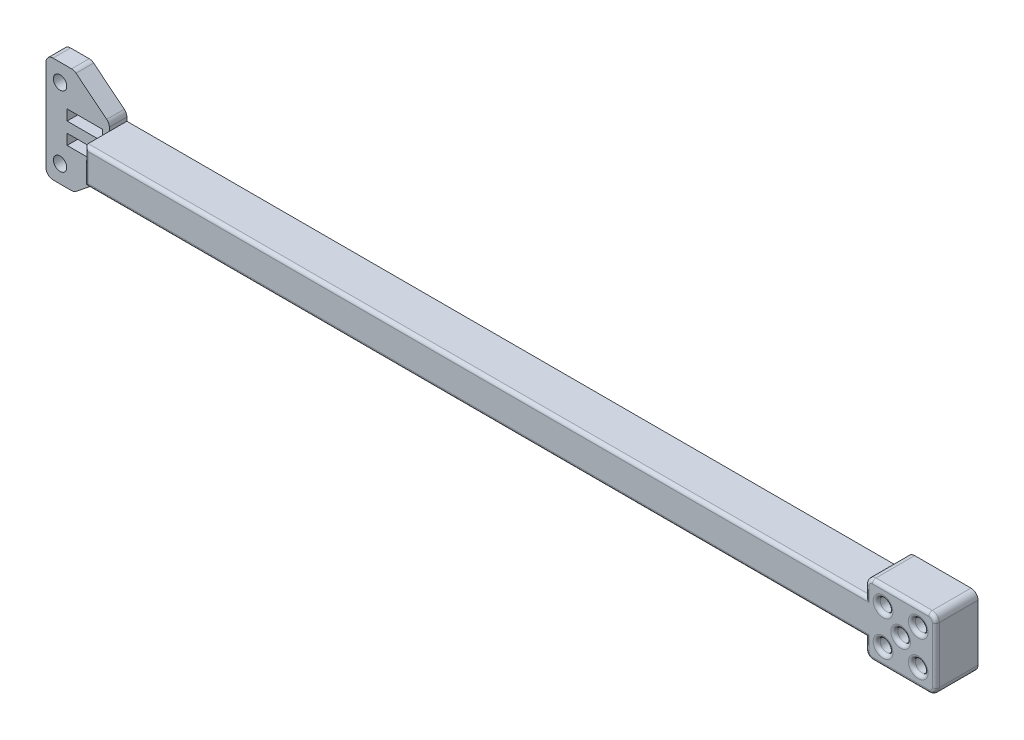
from build123d import *

# Parameters (mm, degrees)
SKETCH1_R           = 2.413
SKETCH1_W           = 12.7
SKETCH1_H           = 3.81
SKETCH1_R_2         = 2.286
BOSS_EXTRUDE1_DEPTH = 6.35
FILLET1_R           = 2.54
SKETCH3_R           = 2.286
BOSS_EXTRUDE3_DEPTH = 8.89
SKETCH7_R           = 4.445
CUT_EXTRUDE2_DEPTH  = 2.54
FILLET3_R           = 1.27


with BuildPart() as part:
    # Sketch1 → Boss-Extrude1 (new body)
    with BuildSketch(Plane.XY):
        Polygon((-140.97, -8.8265), (-140.97, -6.2865), (140.97, -6.2865), (140.97, -12.7), (166.37, -12.7), (166.37, 12.7), (140.97, 12.7), (140.97, 6.2865), (-140.97, 6.2865), (-140.97, 8.8265), (-153.67, 19.05), (-163.83, 19.05), (-163.83, -19.05), (-153.67, -19.05), align=None)
        with Locations((-158.75, -12.7)):
            Circle(SKETCH1_R, mode=Mode.SUBTRACT)
        with Locations((-149.86, -3.81)):
            Rectangle(SKETCH1_W, SKETCH1_H, mode=Mode.SUBTRACT)
        with Locations((-149.86, 3.81)):
            Rectangle(SKETCH1_W, SKETCH1_H, mode=Mode.SUBTRACT)
        with Locations((-158.75, 12.7)):
            Circle(SKETCH1_R, mode=Mode.SUBTRACT)
        with Locations((160.02, 6.35)):
            Circle(SKETCH1_R_2, mode=Mode.SUBTRACT)
        with Locations((147.32, -6.35)):
            Circle(SKETCH1_R_2, mode=Mode.SUBTRACT)
        with Locations((160.02, -6.35)):
            Circle(SKETCH1_R_2, mode=Mode.SUBTRACT)
        with Locations((153.67, 0)):
            Circle(SKETCH1_R_2, mode=Mode.SUBTRACT)
        with Locations((147.32, 6.35)):
            Circle(SKETCH1_R_2, mode=Mode.SUBTRACT)
    extrude(amount=BOSS_EXTRUDE1_DEPTH)

    # Fillet1
    fillet1_edges = [part.edges().sort_by_distance(p)[0] for p in [
        (-140.97, -8.8265, 3.175),
        (-153.67, -19.05, 3.175),
        (-163.83, -19.05, 3.175),
        (-163.83, 19.05, 3.175),
        (-153.67, 19.05, 3.175),
        (-140.97, 8.8265, 3.175),
        (140.97, 12.7, 3.175),
        (140.97, -12.7, 3.175),
        (166.37, -12.7, 3.175),
        (166.37, 12.7, 3.175),
    ]]
    fillet(fillet1_edges, radius=FILLET1_R)

    # Sketch3 → Boss-Extrude3 (add)
    with BuildSketch(Plane.XY.offset(6.35)):
        with BuildLine():
            Line((-140.97, -6.2865), (-140.97, 6.2865))
            Line((-140.97, 6.2865), (140.97, 6.2865))
            Line((140.97, 6.2865), (140.97, 10.16))
            ThreePointArc((140.97, 10.16), (141.713948776, 11.956051224), (143.51, 12.7))
            Line((143.51, 12.7), (163.83, 12.7))
            ThreePointArc((163.83, 12.7), (165.626051224, 11.956051224), (166.37, 10.16))
            Line((166.37, 10.16), (166.37, -10.16))
            ThreePointArc((166.37, -10.16), (165.626051224, -11.956051224), (163.83, -12.7))
            Line((163.83, -12.7), (143.51, -12.7))
            ThreePointArc((143.51, -12.7), (141.713948776, -11.956051224), (140.97, -10.16))
            Line((140.97, -10.16), (140.97, -6.2865))
            Line((140.97, -6.2865), (-140.97, -6.2865))
        make_face()
        with Locations((147.32, 6.35)):
            Circle(SKETCH3_R, mode=Mode.SUBTRACT)
        with Locations((153.67, 0)):
            Circle(SKETCH3_R, mode=Mode.SUBTRACT)
        with Locations((147.32, -6.35)):
            Circle(SKETCH3_R, mode=Mode.SUBTRACT)
        with Locations((160.02, 6.35)):
            Circle(SKETCH3_R, mode=Mode.SUBTRACT)
        with Locations((160.02, -6.35)):
            Circle(SKETCH3_R, mode=Mode.SUBTRACT)
    extrude(amount=BOSS_EXTRUDE3_DEPTH)

    # Sketch7 → Cut-Extrude2 (cut)
    with BuildSketch(Plane(origin=(0, 0, 0), x_dir=(-1, 0, 0), z_dir=(0, 0, -1))):
        with Locations((-147.32, 6.35)):
            Circle(SKETCH7_R)
        with Locations((-160.02, 6.35)):
            Circle(SKETCH7_R)
        with Locations((-160.02, -6.35)):
            Circle(SKETCH7_R)
        with Locations((-147.32, -6.35)):
            Circle(SKETCH7_R)
    extrude(amount=-CUT_EXTRUDE2_DEPTH, mode=Mode.SUBTRACT)

    # Fillet3
    fillet3_edges = [part.edges().sort_by_distance(p)[0] for p in [
        (0, 6.2865, 15.24),
        (-140.97, 0, 15.24),
        (0, -6.2865, 15.24),
        (140.97, -8.22325, 15.24),
        (141.713948776, -11.956051224, 15.24),
        (153.67, -12.7, 15.24),
        (165.626051224, -11.956051224, 15.24),
        (166.37, 0, 15.24),
        (165.626051224, 11.956051224, 15.24),
        (153.67, 12.7, 15.24),
        (141.713948776, 11.956051224, 15.24),
        (140.97, 8.22325, 15.24),
        (145.034, 6.35, 15.24),
        (151.384, 0, 15.24),
        (145.034, -6.35, 15.24),
        (157.734, 6.35, 15.24),
        (157.734, -6.35, 15.24),
    ]]
    fillet(fillet3_edges, radius=FILLET3_R)


solid = part.part
